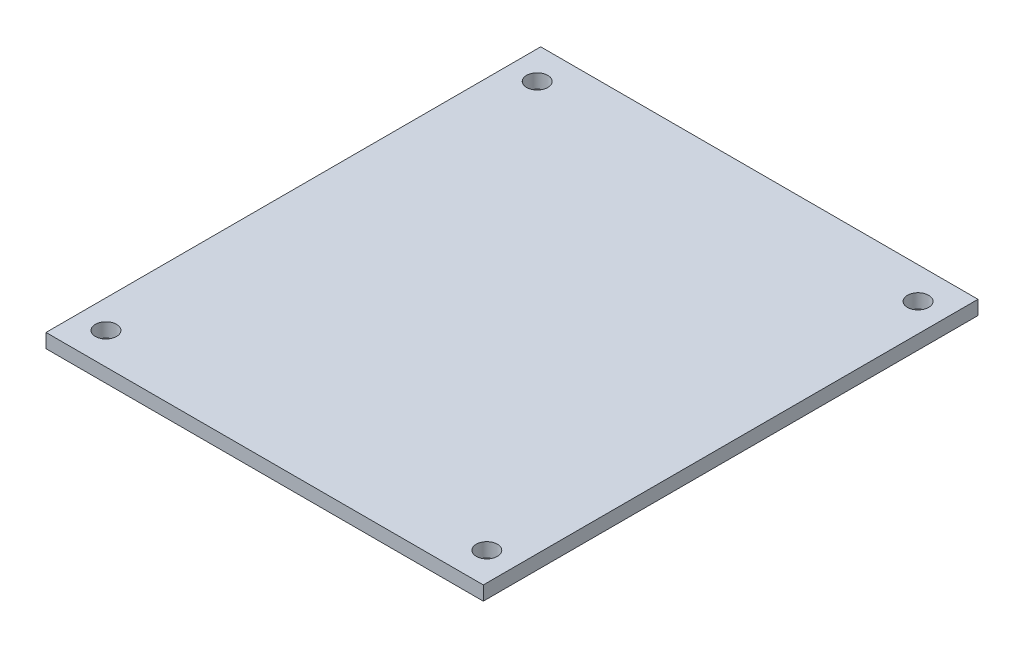
from build123d import *

# Parameters (mm, degrees)
SKETCH_1_W      = 62
SKETCH_1_H      = 70.14
SKETCH_1_R      = 1.5
EXTRUDE_1_DEPTH = 2


with BuildPart() as part:
    # Эскиз1 → Бобышка-Вытянуть1 (new body)
    with BuildSketch(Plane(origin=(0, 0, 0), x_dir=(1, 0, 0), z_dir=(0, 1, 0))):
        with Locations((4.654550133, 12.719556875)):
            Rectangle(SKETCH_1_W, SKETCH_1_H)
        with Locations(Location((-22.345449867, 43.289556875, 0), (0, 0, 270))):
            Circle(SKETCH_1_R, mode=Mode.SUBTRACT)
        with Locations(Location((31.654550133, 43.289556875, 0), (0, 0, 90))):
            Circle(SKETCH_1_R, mode=Mode.SUBTRACT)
        with Locations(Location((31.654550133, -17.850443125, 0), (0, 0, 270))):
            Circle(SKETCH_1_R, mode=Mode.SUBTRACT)
        with Locations(Location((-22.345449867, -17.850443125, 0), (0, 0, 90))):
            Circle(SKETCH_1_R, mode=Mode.SUBTRACT)
    extrude(amount=EXTRUDE_1_DEPTH)


solid = part.part
